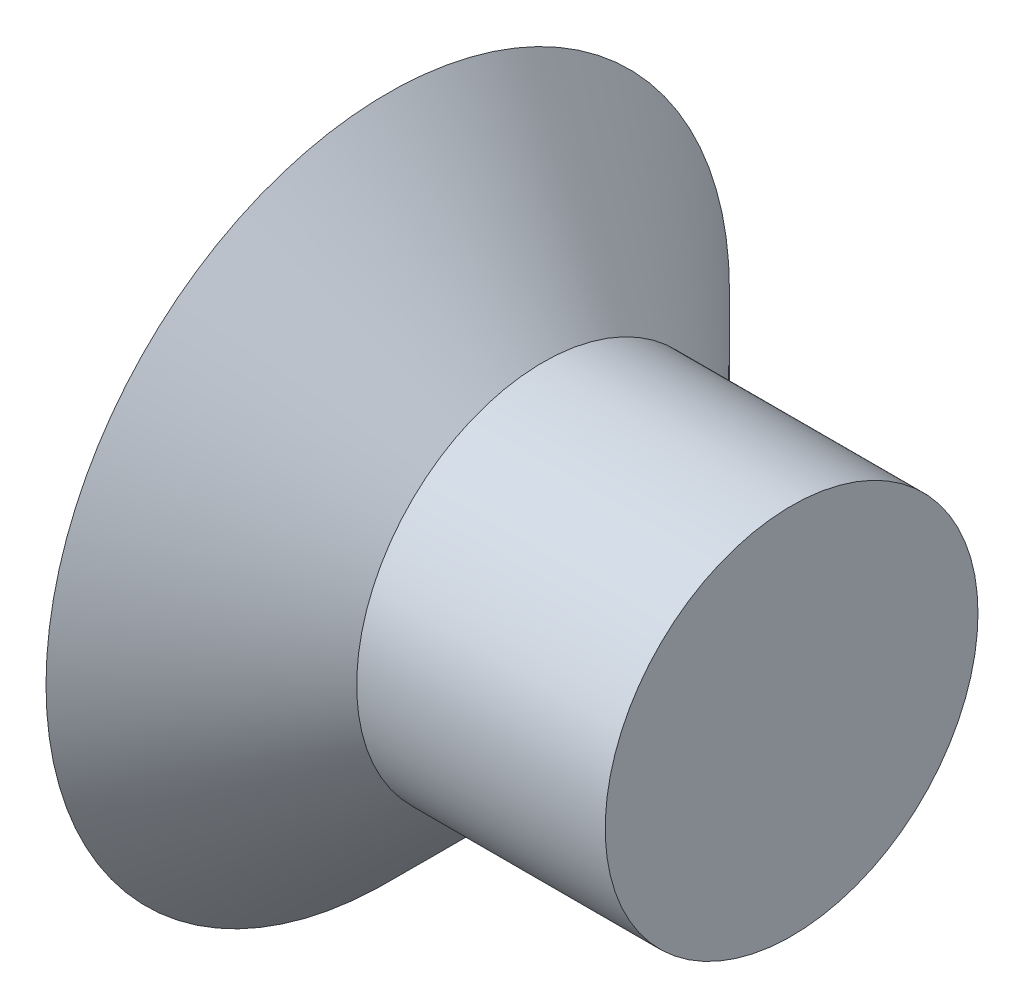
from build123d import *


with BuildPart() as part:
    # Sketch2 → Revolve1 (revolve)
    with BuildSketch(Plane.XY, mode=Mode.PRIVATE) as revolve1_sk:
        Polygon((0, 0), (0, 11), (5, 6), (13, 6), (13, 0), align=None)
    revolve(revolve1_sk.sketch.rotate(Axis((13, 0, 0), (-1, 0, 0)), 90), axis=Axis((13, 0, 0), (-1, 0, 0)))


solid = part.part
